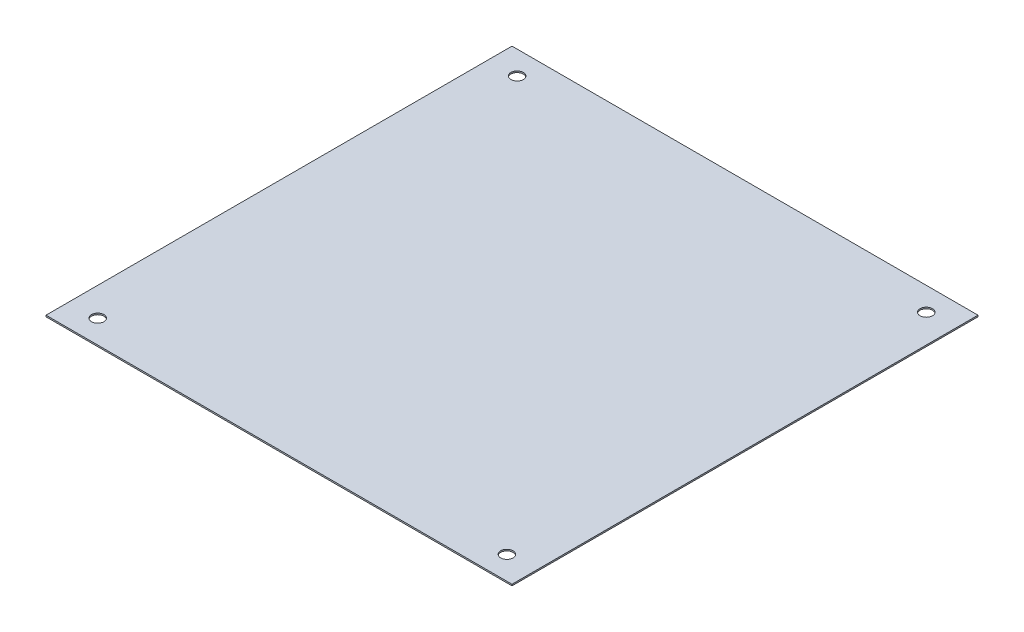
from build123d import *

# Parameters (mm, degrees)
SKETCH1_W           = 254
SKETCH1_H           = 254
SKETCH1_R           = 3.3782
BOSS_EXTRUDE1_DEPTH = 0.79375


with BuildPart() as part:
    # Sketch1 → Boss-Extrude1 (new body)
    with BuildSketch(Plane(origin=(0, 0, 0), x_dir=(1, 0, 0), z_dir=(0, 1, 0))):
        Rectangle(SKETCH1_W, SKETCH1_H)
        with Locations(Location((-111.506, 114.3, 0), (0, 0, 270))):
            Circle(SKETCH1_R, mode=Mode.SUBTRACT)
        with Locations(Location((111.506, 114.3, 0), (0, 0, 270))):
            Circle(SKETCH1_R, mode=Mode.SUBTRACT)
        with Locations(Location((111.506, -114.3, 0), (0, 0, 270))):
            Circle(SKETCH1_R, mode=Mode.SUBTRACT)
        with Locations(Location((-111.506, -114.3, 0), (0, 0, 270))):
            Circle(SKETCH1_R, mode=Mode.SUBTRACT)
    extrude(amount=BOSS_EXTRUDE1_DEPTH)


solid = part.part
